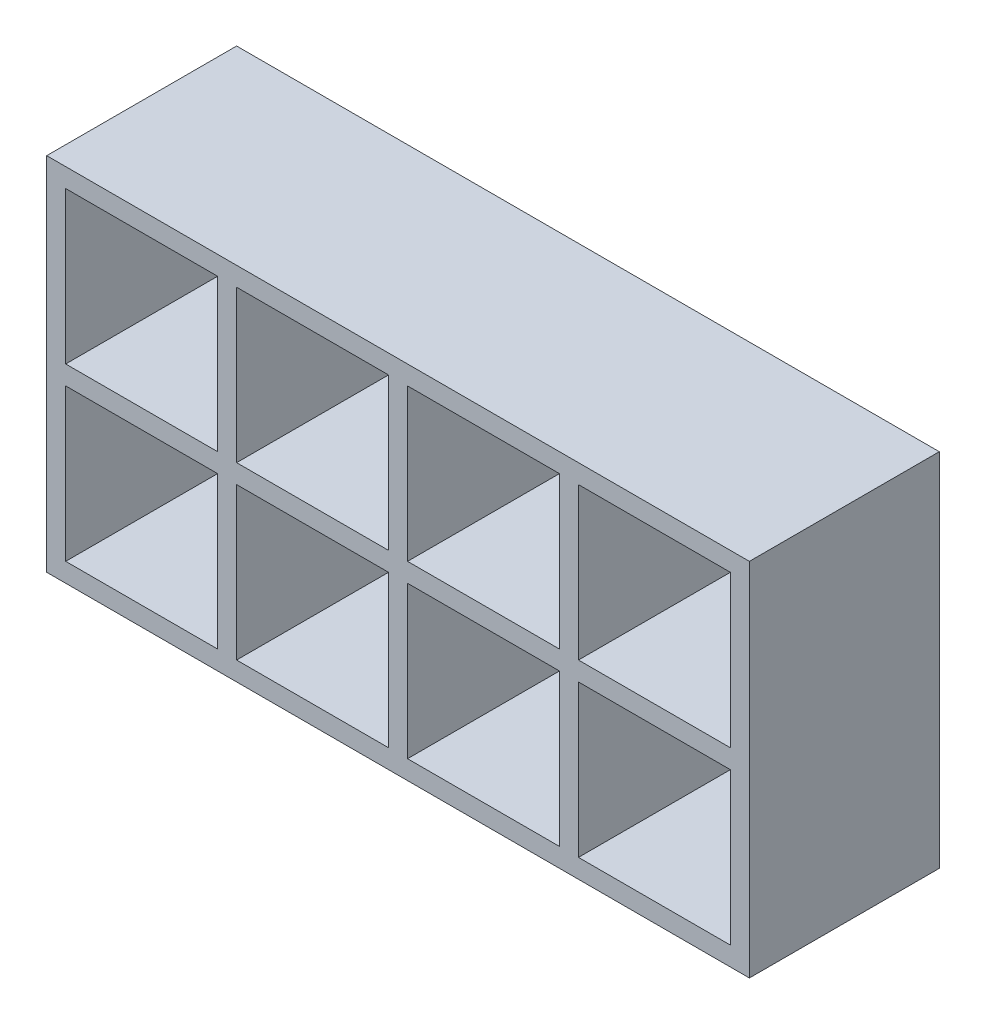
from build123d import *

# Parameters (mm, degrees)
SKETCH1_W           = 185
SKETCH1_H           = 95
SKETCH1_W_2         = 40
SKETCH1_H_2         = 40
BOSS_EXTRUDE1_DEPTH = 50


with BuildPart() as part:
    # Sketch1 → Boss-Extrude1 (new body)
    with BuildSketch(Plane.XY):
        with Locations((-92.5, 47.5)):
            Rectangle(SKETCH1_W, SKETCH1_H)
        with Locations((-160, 25)):
            Rectangle(SKETCH1_W_2, SKETCH1_H_2, mode=Mode.SUBTRACT)
        with Locations((-115, 25)):
            Rectangle(SKETCH1_W_2, SKETCH1_H_2, mode=Mode.SUBTRACT)
        with Locations((-70, 25)):
            Rectangle(SKETCH1_W_2, SKETCH1_H_2, mode=Mode.SUBTRACT)
        with Locations((-25, 25)):
            Rectangle(SKETCH1_W_2, SKETCH1_H_2, mode=Mode.SUBTRACT)
        with Locations((-25, 70)):
            Rectangle(SKETCH1_W_2, SKETCH1_H_2, mode=Mode.SUBTRACT)
        with Locations((-70, 70)):
            Rectangle(SKETCH1_W_2, SKETCH1_H_2, mode=Mode.SUBTRACT)
        with Locations((-115, 70)):
            Rectangle(SKETCH1_W_2, SKETCH1_H_2, mode=Mode.SUBTRACT)
        with Locations((-160, 70)):
            Rectangle(SKETCH1_W_2, SKETCH1_H_2, mode=Mode.SUBTRACT)
    extrude(amount=BOSS_EXTRUDE1_DEPTH)


solid = part.part
